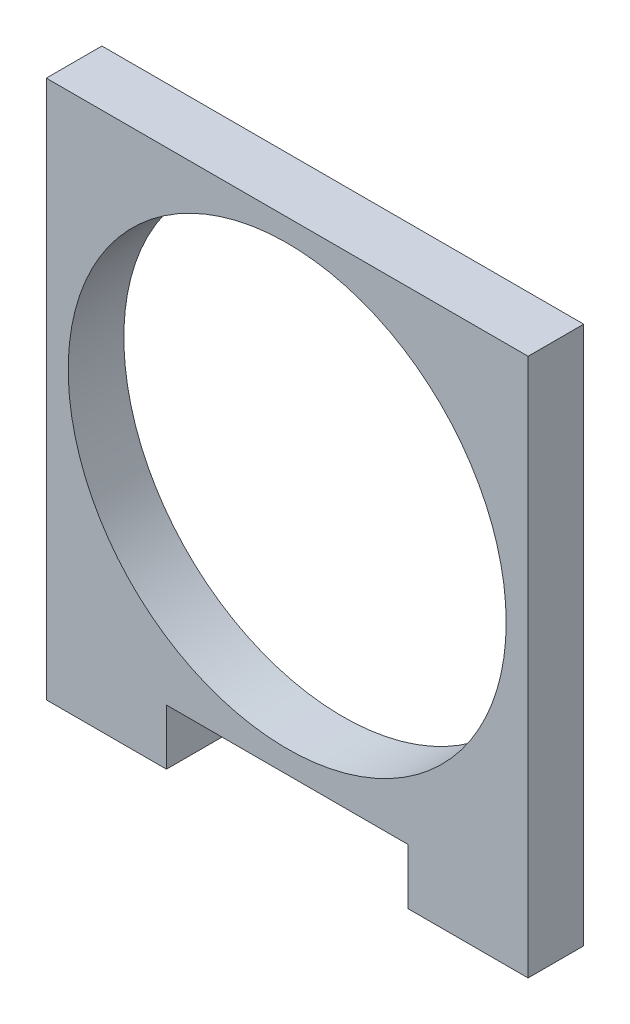
from build123d import *

# Parameters (mm, degrees)
BOSS_EXTRUDE1_DEPTH     = 6.35
CUT_EXTRUDE1_DEPTH      = 79.123725091
CUT_EXTRUDE1_DEPTH_BACK = 79.123725091
SKETCH3_R               = 25.000000038


with BuildPart() as part:
    # Sketch2 → Boss-Extrude1 (new body)
    with BuildSketch(Plane.XY):
        Polygon((13.716, 0), (41.283999982, 0), (41.283999982, -6.35), (54.999999982, -6.35), (54.999999982, 0), (54.999999982, 55.118), (0, 55.118), (0, 0), (0, -6.35), (13.716, -6.35), align=None)
    extrude(amount=BOSS_EXTRUDE1_DEPTH)

    # Sketch3 → Cut-Extrude1 (cut, two sides: drawn at the far end of the back side and taken through both)
    with BuildSketch(Plane.XY.offset(6.35).offset(-CUT_EXTRUDE1_DEPTH_BACK)):
        with Locations((27.499999991, 27.559)):
            Circle(SKETCH3_R)
    extrude(amount=CUT_EXTRUDE1_DEPTH + CUT_EXTRUDE1_DEPTH_BACK, mode=Mode.SUBTRACT)


solid = part.part
